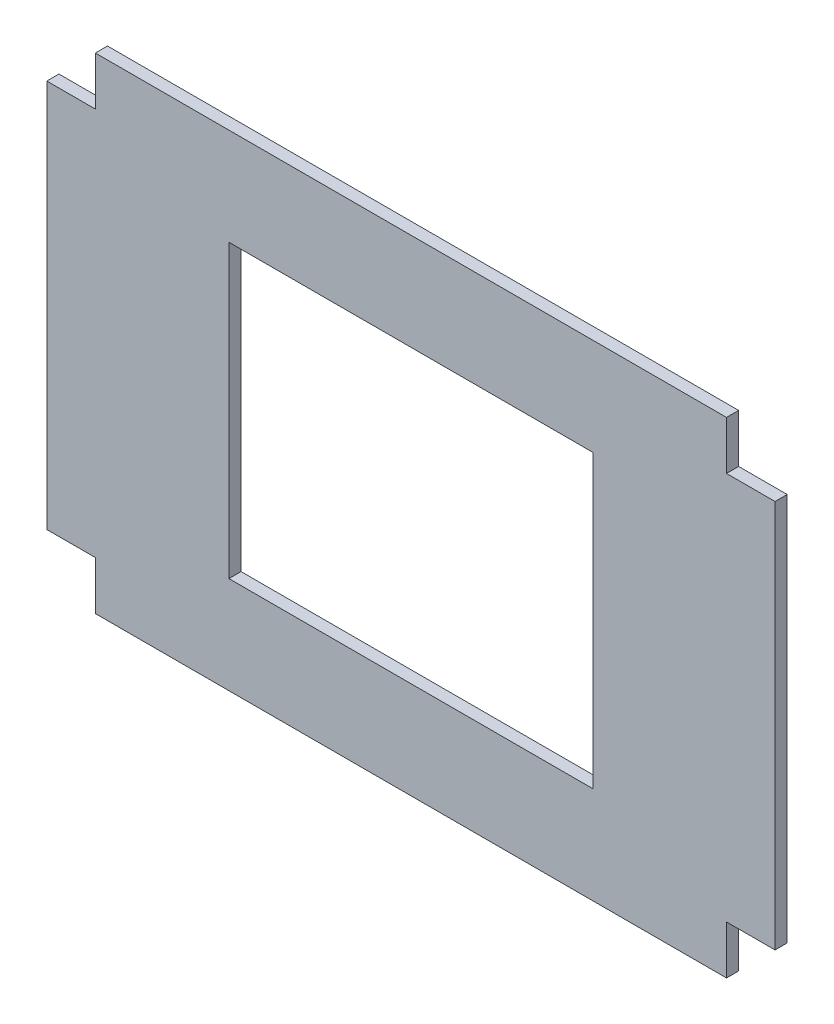
from build123d import *

# Parameters (mm, degrees)
CROQUIS1_W              = 300
CROQUIS1_H              = 200
SALIENTE_EXTRUIR1_DEPTH = 5
CROQUIS4_W              = 20
CROQUIS4_H              = 20
CORTAR_EXTRUIR4_DEPTH   = 10
CROQUIS5_W              = 150
CROQUIS5_H              = 120
CORTAR_EXTRUIR6_DEPTH   = 10


with BuildPart() as part:
    # Croquis1 → Saliente-Extruir1 (new body)
    with BuildSketch(Plane.XY):
        with Locations((-144.934554974, -91.263089005)):
            Rectangle(CROQUIS1_W, CROQUIS1_H)
    extrude(amount=SALIENTE_EXTRUIR1_DEPTH)

    # Croquis4 → Cortar-Extruir4 (cut)
    with BuildSketch(Plane.XY.offset(5)):
        with Locations((-284.934554974, -1.263089005)):
            Rectangle(CROQUIS4_W, CROQUIS4_H)
        with Locations((-4.934554974, -1.263089005)):
            Rectangle(CROQUIS4_W, CROQUIS4_H)
        with Locations((-284.934554974, -181.263089005)):
            Rectangle(CROQUIS4_W, CROQUIS4_H)
        with Locations((-4.934554974, -181.263089005)):
            Rectangle(CROQUIS4_W, CROQUIS4_H)
    extrude(amount=-CORTAR_EXTRUIR4_DEPTH, mode=Mode.SUBTRACT)

    # Croquis5 → Cortar-Extruir6 (cut)
    with BuildSketch(Plane.XY.offset(5)):
        with Locations((-144.934554974, -91.263089005)):
            Rectangle(CROQUIS5_W, CROQUIS5_H)
    extrude(amount=-CORTAR_EXTRUIR6_DEPTH, mode=Mode.SUBTRACT)


solid = part.part
